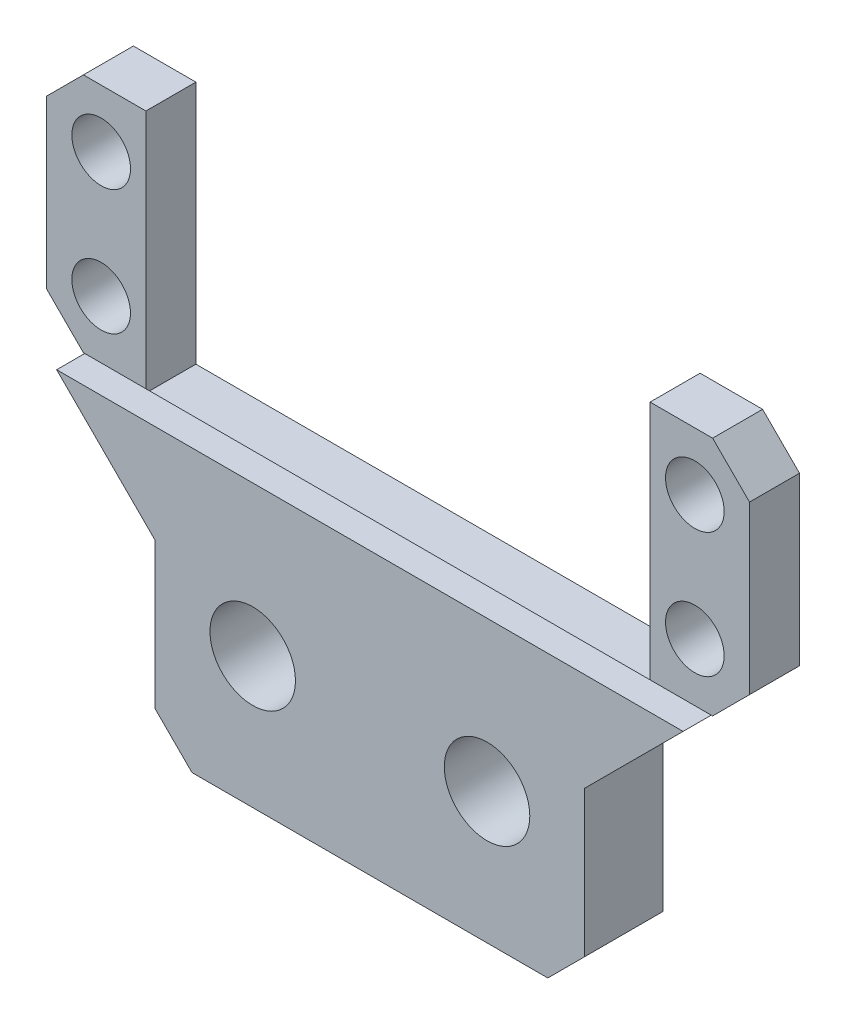
from build123d import *

# Parameters (mm, degrees)
SKETCH1_R           = 3.475
SKETCH1_R_2         = 2.3828
BOSS_EXTRUDE1_DEPTH = 6.35
CHAMFER1_SIZE       = 3
CHAMFER2_SIZE       = 8
CUT_EXTRUDE1_DEPTH  = 2.286
SKETCH4_W           = 40.986
SKETCH4_H           = 20.158
CUT_EXTRUDE2_DEPTH  = 36.817152344


with BuildPart() as part:
    # Sketch1 → Boss-Extrude1 (new body)
    with BuildSketch(Plane.XY):
        Polygon((17.4625, -21.209), (-17.4625, -21.209), (-17.4625, 1.651), (-28.575, 1.651), (-28.575, 21.209), (28.575, 21.209), (28.575, 1.651), (17.4625, 1.651), align=None)
        with Locations((-9.525, -10.541)):
            Circle(SKETCH1_R, mode=Mode.SUBTRACT)
        with Locations((9.525, -10.541)):
            Circle(SKETCH1_R, mode=Mode.SUBTRACT)
        with Locations((-24.13, 6.35)):
            Circle(SKETCH1_R_2, mode=Mode.SUBTRACT)
        with Locations((-24.13, 16.51)):
            Circle(SKETCH1_R_2, mode=Mode.SUBTRACT)
        with Locations((24.13, 16.51)):
            Circle(SKETCH1_R_2, mode=Mode.SUBTRACT)
        with Locations((24.13, 6.35)):
            Circle(SKETCH1_R_2, mode=Mode.SUBTRACT)
    extrude(amount=BOSS_EXTRUDE1_DEPTH)

    # Chamfer1
    chamfer1_edges = [part.edges().sort_by_distance(p)[0] for p in [
        (-28.575, 1.651, 3.175),
        (-28.575, 21.209, 3.175),
        (28.575, 21.209, 3.175),
        (28.575, 1.651, 3.175),
        (17.4625, -21.209, 3.175),
        (-17.4625, -21.209, 3.175),
    ]]
    chamfer(chamfer1_edges, length=CHAMFER1_SIZE)

    # Chamfer2
    chamfer2_edges = [part.edges().sort_by_distance(p)[0] for p in [
        (17.4625, 1.651, 3.175),
        (-17.4625, 1.651, 3.175),
    ]]
    chamfer(chamfer2_edges, length=CHAMFER2_SIZE)

    # Sketch3 → Cut-Extrude1 (cut)
    with BuildSketch(Plane.XY.offset(6.35)):
        Polygon((-25.4625, 1.651), (25.4625, 1.651), (25.575, 1.651), (28.575, 4.651), (28.575, 18.209), (25.575, 21.209), (-25.575, 21.209), (-28.575, 18.209), (-28.575, 4.651), (-25.575, 1.651), align=None)
    extrude(amount=-CUT_EXTRUDE1_DEPTH, mode=Mode.SUBTRACT)

    # Sketch4 → Cut-Extrude2 (cut, through all)
    with BuildSketch(Plane.XY.offset(4.064)):
        with Locations((0, 11.43)):
            Rectangle(SKETCH4_W, SKETCH4_H)
    extrude(amount=-CUT_EXTRUDE2_DEPTH, mode=Mode.SUBTRACT)


solid = part.part
